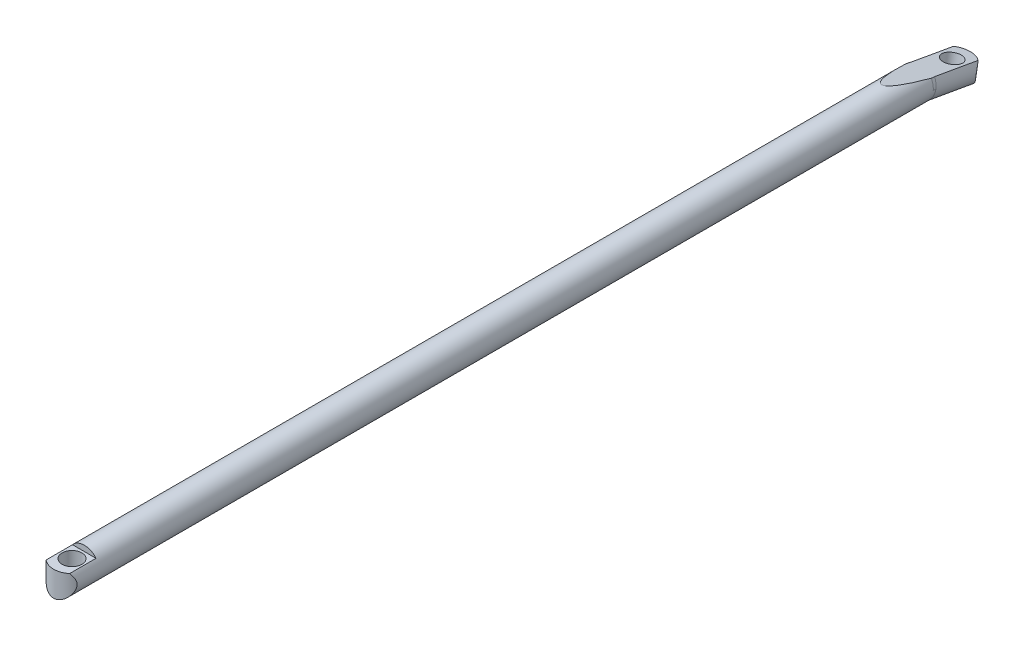
from build123d import *

# Parameters (mm, degrees)
SKETCH2_R           = 12.5
BOSS_EXTRUDE1_DEPTH = 680
BOSS_EXTRUDE7_REACH = 684.374
SKETCH17_R          = 12.5
SKETCH18_R          = 21.64199716
SKETCH18_R_2        = 12.5
CUT_EXTRUDE6_DEPTH  = 685.540071193
BOSS_EXTRUDE8_DEPTH = 40
CUT_EXTRUDE7_DEPTH  = 722.910412641
SKETCH21_R          = 7.5
CUT_EXTRUDE8_DEPTH  = 682.877047211
BOSS_EXTRUDE9_START = 25
BOSS_EXTRUDE9_DEPTH = 25
SKETCH24_R          = 8.10155649
CUT_EXTRUDE9_DEPTH  = 706.644761137


with BuildPart() as part:
    # Sketch2 → Boss-Extrude1 (new body)
    with BuildSketch(Plane.XY):
        Circle(SKETCH2_R)
    extrude(amount=BOSS_EXTRUDE1_DEPTH)

    # Boss-Extrude7: up to this face of the body (flat: up to its plane)
    boss_extrude7_end = Plane(part.part.faces().sort_by_distance((0, 0, 0))[0])
    # Sketch17 → Boss-Extrude7 (add, up to the picked face)
    with BuildSketch(Plane(origin=(0, -0.37692112, -2.137625896), x_dir=(-1, 0, 0), z_dir=(0, -0.17364817766693072, -0.984807753012208)), mode=Mode.PRIVATE) as boss_extrude7_sk1:
        Circle(SKETCH17_R)
    boss_extrude7_tool1 = split(extrude(boss_extrude7_sk1.sketch, amount=-BOSS_EXTRUDE7_REACH, mode=Mode.PRIVATE), bisect_by=boss_extrude7_end, keep=Keep.BOTH, mode=Mode.PRIVATE)
    add(boss_extrude7_tool1.solids().sort_by(Axis((0, -0.376921, -2.137626), (0, 0.17364817766693072, 0.984807753012208)))[0])

    # Sketch18 → Cut-Extrude6 (cut, through all)
    with BuildSketch(Plane.XY.offset(680)):
        Circle(SKETCH18_R)
        Circle(SKETCH18_R_2, mode=Mode.SUBTRACT)
    extrude(amount=-CUT_EXTRUDE6_DEPTH, mode=Mode.SUBTRACT)

    # Sketch19 → Boss-Extrude8 (add)
    with BuildSketch(Plane(origin=(0, -0.37692112, -2.137625896), x_dir=(-1, 0, 0), z_dir=(0, -0.17364817766693072, -0.9848077530122081))):
        with BuildLine():
            Line((-10, 7.179030993), (10, 7.179030993))
            ThreePointArc((10, 7.179030993), (0, -12.310096913), (-10, 7.179030993))
        make_face()
    extrude(amount=BOSS_EXTRUDE8_DEPTH)

    # Sketch20 → Cut-Extrude7 (cut, through all)
    with BuildSketch(Plane(origin=(0, -7.322848227, -41.529936016), x_dir=(-1, 0, 0), z_dir=(0, -0.17364817766693075, -0.9848077530122081))):
        Polygon((-10, 7.179030993), (-31.533924825, 7.179030993), (-13.913821083, 23.302885617), (27.950999048, 17.361222727), (22.214221085, 5.955961778), (10, 7.179030993), align=None)
    extrude(amount=-CUT_EXTRUDE7_DEPTH, mode=Mode.SUBTRACT)

    # Sketch21 → Cut-Extrude8 (cut, through all)
    with BuildSketch(Plane(origin=(0, 7.069965381, -1.246625649), x_dir=(1, 0, 0), z_dir=(0, 0.9848077530122081, -0.1736481776669307))):
        with Locations(Location((0, 27.170602221, 0), (0, 0, 270))):
            Circle(SKETCH21_R)
        with BuildLine():
            Line((-15, 27.170602221), (-29.909337142, 27.170602221))
            Line((-29.909337142, 27.170602221), (-31.20991729, 57.226860982))
            Line((-31.20991729, 57.226860982), (35.119670244, 57.226860982))
            Line((35.119670244, 57.226860982), (27.037493612, 28.799894896))
            Line((27.037493612, 28.799894896), (15, 27.170602221))
            ThreePointArc((15, 27.170602221), (0, 42.170602221), (-15, 27.170602221))
        make_face()
    extrude(amount=-CUT_EXTRUDE8_DEPTH, mode=Mode.SUBTRACT)

    # Sketch23 → Boss-Extrude9 (add)
    with BuildSketch(Plane.XY.offset(680).offset(BOSS_EXTRUDE9_START)):
        with BuildLine():
            Line((-9.604686356, 8), (9.604686356, 8))
            ThreePointArc((9.604686356, 8), (0, -12.5), (-9.604686356, 8))
        make_face()
    extrude(amount=-BOSS_EXTRUDE9_DEPTH)

    # Sketch24 → Cut-Extrude9 (cut, through all)
    with BuildSketch(Plane(origin=(0, 8, 0), x_dir=(1, 0, 0), z_dir=(0, 1, 0))):
        with Locations(Location((0, -690, 0), (0, 0, 270))):
            Circle(SKETCH24_R)
        with BuildLine():
            Line((-15, -690), (-15, -735.171445315))
            Line((-15, -735.171445315), (15, -735.171445315))
            Line((15, -735.171445315), (15, -690))
            ThreePointArc((15, -690), (0, -705), (-15, -690))
        make_face()
    extrude(amount=-CUT_EXTRUDE9_DEPTH, mode=Mode.SUBTRACT)


solid = part.part
